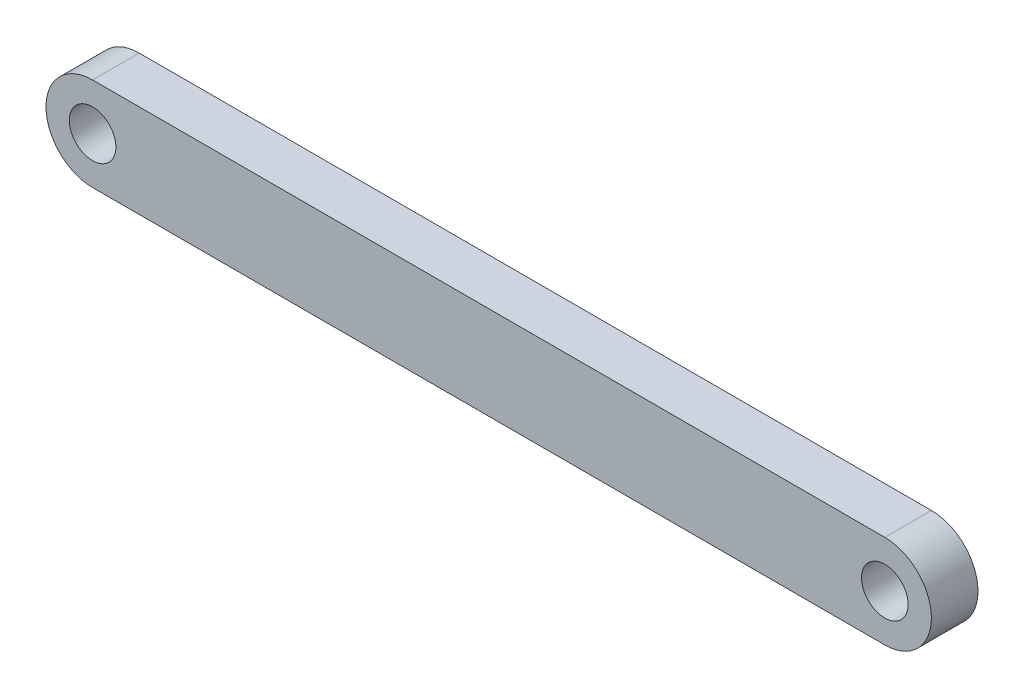
from build123d import *

# Parameters (mm, degrees)
SKETCH_1_R      = 1
EXTRUDE_1_DEPTH = 2


with BuildPart() as part:
    # 草圖1 → 填料-伸長1 (new body)
    with BuildSketch(Plane.XY):
        with BuildLine():
            Line((-16.999999977, 2.000877158), (17.000000023, 2.000877158))
            ThreePointArc((17.000000023, 2.000877158), (19.000000023, 0.000877158), (17.000000023, -1.999122842))
            Line((17.000000023, -1.999122842), (-16.999999977, -1.999122842))
            ThreePointArc((-16.999999977, -1.999122842), (-18.999999977, 0.000877158), (-16.999999977, 2.000877158))
        make_face()
        with Locations((-16.999999977, 0.000877158)):
            Circle(SKETCH_1_R, mode=Mode.SUBTRACT)
        with Locations((17.000000023, 0.000877158)):
            Circle(SKETCH_1_R, mode=Mode.SUBTRACT)
    extrude(amount=EXTRUDE_1_DEPTH)


solid = part.part
